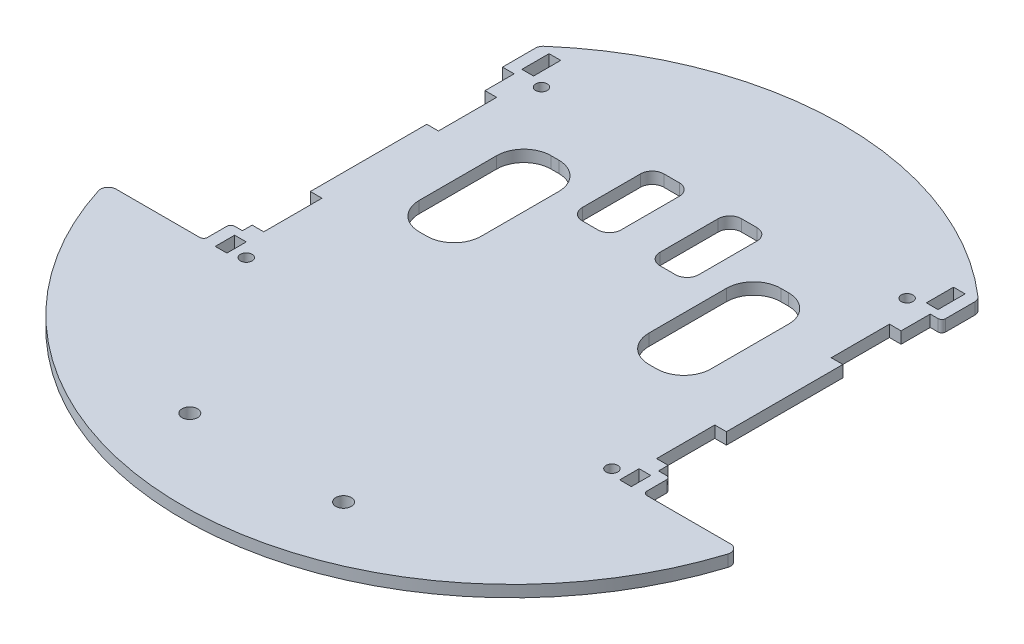
from build123d import *

# Parameters (mm, degrees)
SKETCH1_R           = 1.5
SKETCH1_R_2         = 2
SKETCH1_W           = 3
SKETCH1_H           = 5
SKETCH1_H_2         = 7
BOSS_EXTRUDE1_DEPTH = 3


with BuildPart() as part:
    # Sketch1 → Boss-Extrude1 (new body)
    with BuildSketch(Plane(origin=(0, 0, 0), x_dir=(1, 0, 0), z_dir=(0, 1, 0))):
        with BuildLine():
            Line((11.699698215, 30.641238244), (11.699698215, 38.128019164))
            ThreePointArc((11.699698215, 38.128019164), (11.520568227, 38.955323461), (11.015265815, 39.634432749))
            ThreePointArc((11.015265815, 39.634432749), (-44.896357171, 60.611855364), (-100.807980157, 39.634432749))
            ThreePointArc((-100.807980157, 39.634432749), (-101.313282569, 38.955323461), (-101.492412558, 38.128019164))
            Line((-101.492412558, 38.128019164), (-101.492412558, 29.641238244))
            Line((-101.492412558, 29.641238244), (-98.492412558, 29.641238244))
            Line((-98.492412558, 29.641238244), (-98.492412558, 22.141238244))
            Line((-98.492412558, 22.141238244), (-95.492412558, 22.141238244))
            Line((-95.492412558, 22.141238244), (-95.492412558, 7.141238244))
            Line((-95.492412558, 7.141238244), (-98.492412558, 7.141238244))
            Line((-98.492412558, 7.141238244), (-98.492412558, -22.858761756))
            Line((-98.492412558, -22.858761756), (-95.492412558, -22.858761756))
            Line((-95.492412558, -22.858761756), (-95.492412558, -37.858761756))
            Line((-95.492412558, -37.858761756), (-98.492412558, -37.858761756))
            Line((-98.492412558, -37.858761756), (-98.492412558, -40.358761756))
            Line((-98.492412558, -40.358761756), (-100.492412558, -40.358761756))
            ThreePointArc((-100.492412558, -40.358761756), (-101.199519339, -40.651654975), (-101.492412558, -41.358761756))
            Line((-101.492412558, -41.358761756), (-101.492412558, -46.358761756))
            ThreePointArc((-101.492412558, -46.358761756), (-101.785305776, -47.065868537), (-102.492412558, -47.358761756))
            Line((-102.492412558, -47.358761756), (-124.051068216, -47.358761756))
            ThreePointArc((-124.051068216, -47.358761756), (-125.664047329, -48.176265083), (-125.958410651, -49.960463374))
            ThreePointArc((-125.958410651, -49.960463374), (-44.896357171, -109.388144636), (36.165696309, -49.960463373))
            ThreePointArc((36.165696309, -49.960463373), (35.871332987, -48.176265083), (34.258353874, -47.358761756))
            Line((34.258353874, -47.358761756), (12.699698215, -47.358761756))
            ThreePointArc((12.699698215, -47.358761756), (11.992591434, -47.065868537), (11.699698215, -46.358761756))
            Line((11.699698215, -46.358761756), (11.699698215, -41.358761756))
            ThreePointArc((11.699698215, -41.358761756), (11.406804997, -40.651654975), (10.699698215, -40.358761756))
            Line((10.699698215, -40.358761756), (8.699698215, -40.358761756))
            Line((8.699698215, -40.358761756), (8.699698215, -37.858761756))
            Line((8.699698215, -37.858761756), (5.699698215, -37.858761756))
            Line((5.699698215, -37.858761756), (5.699698215, -22.858761756))
            Line((5.699698215, -22.858761756), (8.699698215, -22.858761756))
            Line((8.699698215, -22.858761756), (8.699698215, 7.141238244))
            Line((8.699698215, 7.141238244), (5.699698215, 7.141238244))
            Line((5.699698215, 7.141238244), (5.699698215, 22.141238244))
            Line((5.699698215, 22.141238244), (8.699698215, 22.141238244))
            Line((8.699698215, 22.141238244), (8.699698215, 29.641238244))
            Line((8.699698215, 29.641238244), (10.699698215, 29.641238244))
            ThreePointArc((10.699698215, 29.641238244), (11.406804996, 29.934131463), (11.699698215, 30.641238244))
        make_face()
        with Locations(Location((2.199698215, 30.187503495, 0), (0, 0, 270))):
            Circle(SKETCH1_R, mode=Mode.SUBTRACT)
        with Locations(Location((2.199698215, -45.858761756, 0), (0, 0, 270))):
            Circle(SKETCH1_R, mode=Mode.SUBTRACT)
        with Locations(Location((-91.992412558, -45.858761756, 0), (0, 0, 270))):
            Circle(SKETCH1_R, mode=Mode.SUBTRACT)
        with Locations(Location((-91.992412558, 30.187503495, 0), (0, 0, 270))):
            Circle(SKETCH1_R, mode=Mode.SUBTRACT)
        with Locations(Location((-24.942412558, -87.858761756, 0), (0, 0, 270))):
            Circle(SKETCH1_R_2, mode=Mode.SUBTRACT)
        with Locations(Location((-64.542412558, -87.858761756, 0), (0, 0, 270))):
            Circle(SKETCH1_R_2, mode=Mode.SUBTRACT)
        with Locations((-96.992412558, -44.858761756)):
            Rectangle(SKETCH1_W, SKETCH1_H, mode=Mode.SUBTRACT)
        with Locations((7.199698215, 35.141238244)):
            Rectangle(SKETCH1_W, SKETCH1_H_2, mode=Mode.SUBTRACT)
        with Locations((7.199698215, -44.858761756)):
            Rectangle(SKETCH1_W, SKETCH1_H, mode=Mode.SUBTRACT)
        with BuildLine():
            Line((-75.492412558, 16.141238244), (-73.492412558, 16.141238244))
            ThreePointArc((-73.492412558, 16.141238244), (-68.542665089, 14.090985712), (-66.492412558, 9.141238244))
            Line((-66.492412558, 9.141238244), (-66.492412558, -10.829459129))
            ThreePointArc((-66.492412558, -10.829459129), (-68.542665089, -15.779206597), (-73.492412558, -17.829459129))
            Line((-73.492412558, -17.829459129), (-75.492412558, -17.829459129))
            ThreePointArc((-75.492412558, -17.829459129), (-80.442160026, -15.779206597), (-82.492412558, -10.829459129))
            Line((-82.492412558, -10.829459129), (-82.492412558, 9.141238244))
            ThreePointArc((-82.492412558, 9.141238244), (-80.442160026, 14.090985712), (-75.492412558, 16.141238244))
        make_face(mode=Mode.SUBTRACT)
        with Locations((-96.992412558, 35.141238244)):
            Rectangle(SKETCH1_W, SKETCH1_H_2, mode=Mode.SUBTRACT)
        with BuildLine():
            Line((-29.896357171, 23.611855364), (-29.896357171, 8.611855364))
            ThreePointArc((-29.896357171, 8.611855364), (-30.775036828, 6.49053502), (-32.896357171, 5.611855364))
            Line((-32.896357171, 5.611855364), (-36.896357171, 5.611855364))
            ThreePointArc((-36.896357171, 5.611855364), (-39.017677515, 6.49053502), (-39.896357171, 8.611855364))
            Line((-39.896357171, 8.611855364), (-39.896357171, 23.611855364))
            ThreePointArc((-39.896357171, 23.611855364), (-39.017677515, 25.733175707), (-36.896357171, 26.611855364))
            Line((-36.896357171, 26.611855364), (-32.896357171, 26.611855364))
            ThreePointArc((-32.896357171, 26.611855364), (-30.775036828, 25.733175707), (-29.896357171, 23.611855364))
        make_face(mode=Mode.SUBTRACT)
        with BuildLine():
            Line((-56.896357171, 5.611855364), (-52.896357171, 5.611855364))
            ThreePointArc((-52.896357171, 5.611855364), (-50.775036828, 6.49053502), (-49.896357171, 8.611855364))
            Line((-49.896357171, 8.611855364), (-49.896357171, 23.611855364))
            ThreePointArc((-49.896357171, 23.611855364), (-50.775036828, 25.733175707), (-52.896357171, 26.611855364))
            Line((-52.896357171, 26.611855364), (-56.896357171, 26.611855364))
            ThreePointArc((-56.896357171, 26.611855364), (-59.017677515, 25.733175707), (-59.896357171, 23.611855364))
            Line((-59.896357171, 23.611855364), (-59.896357171, 8.611855364))
            ThreePointArc((-59.896357171, 8.611855364), (-59.017677515, 6.49053502), (-56.896357171, 5.611855364))
        make_face(mode=Mode.SUBTRACT)
        with BuildLine():
            Line((-7.300301785, 9.141238244), (-7.300301785, -10.829459129))
            ThreePointArc((-7.300301785, -10.829459129), (-9.350554316, -15.779206597), (-14.300301785, -17.829459129))
            Line((-14.300301785, -17.829459129), (-16.300301785, -17.829459129))
            ThreePointArc((-16.300301785, -17.829459129), (-21.250049253, -15.779206597), (-23.300301785, -10.829459129))
            Line((-23.300301785, -10.829459129), (-23.300301785, 9.141238244))
            ThreePointArc((-23.300301785, 9.141238244), (-21.250049253, 14.090985712), (-16.300301785, 16.141238244))
            Line((-16.300301785, 16.141238244), (-14.300301785, 16.141238244))
            ThreePointArc((-14.300301785, 16.141238244), (-9.350554316, 14.090985712), (-7.300301785, 9.141238244))
        make_face(mode=Mode.SUBTRACT)
    extrude(amount=BOSS_EXTRUDE1_DEPTH)


solid = part.part
